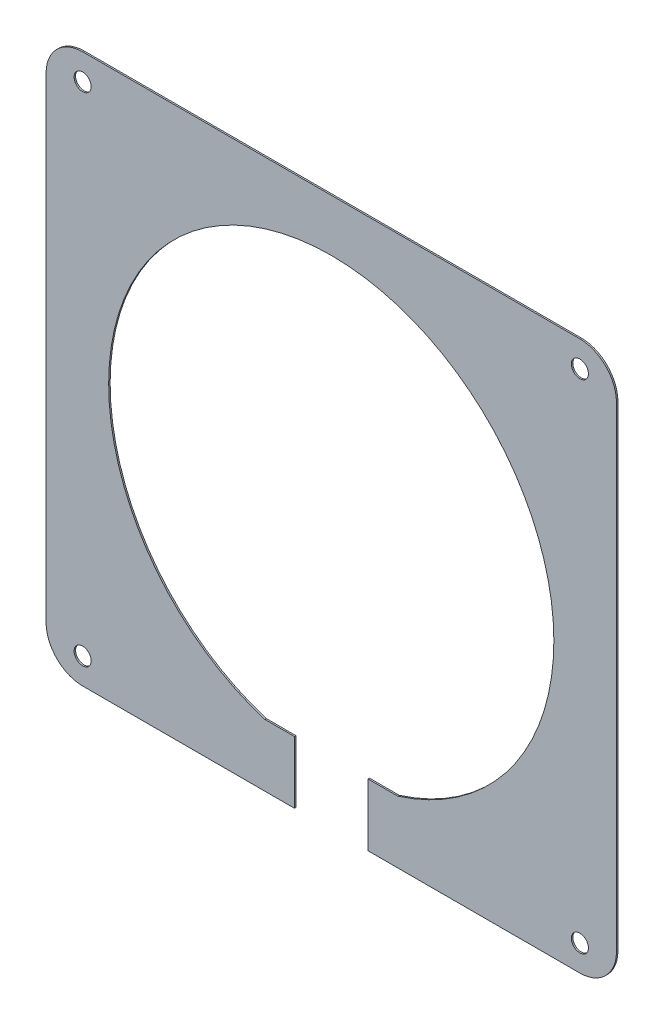
from build123d import *

# Parameters (mm, degrees)
SKETCH2_R           = 1.475
BOSS_EXTRUDE1_DEPTH = 0.254
FILLET1_R           = 6.35


with BuildPart() as part:
    # Sketch2 → Boss-Extrude1 (new body)
    # profile 1 of 3: a face of its own
    with BuildSketch(Plane.XY):
        with BuildLine():
            ThreePointArc((-6.35, -37.972720471), (-8.946176851, -37.446173633), (-11.5, -36.742346142))
            ThreePointArc((-11.5, -36.742346142), (-22.79802623, 31.024184115), (38.5, 0))
            ThreePointArc((38.5, 0), (31.024184115, -22.79802623), (11.5, -36.742346142))
            ThreePointArc((11.5, -36.742346142), (8.946176851, -37.446173633), (6.35, -37.972720471))
            Line((6.35, -37.972720471), (6.35, -47.5))
            Line((6.35, -47.5), (49.325, -47.5))
            Line((49.325, -47.5), (49.325, 47.5))
            Line((49.325, 47.5), (-49.325, 47.5))
            Line((-49.325, 47.5), (-49.325, -47.5))
            Line((-49.325, -47.5), (-6.35, -47.5))
            Line((-6.35, -47.5), (-6.35, -37.972720471))
        make_face()
        with Locations((-43, -43)):
            Circle(SKETCH2_R, mode=Mode.SUBTRACT)
        with Locations((43, -43)):
            Circle(SKETCH2_R, mode=Mode.SUBTRACT)
        with Locations((-43, 43)):
            Circle(SKETCH2_R, mode=Mode.SUBTRACT)
        with Locations((43, 43)):
            Circle(SKETCH2_R, mode=Mode.SUBTRACT)
    # profile 2 of 3: a face of its own
    with BuildSketch(Plane.XY):
        with BuildLine():
            Line((11.5, -36.742346142), (6.35, -36.742346142))
            Line((6.35, -36.742346142), (6.35, -37.972720471))
            ThreePointArc((6.35, -37.972720471), (8.946176851, -37.446173633), (11.5, -36.742346142))
        make_face()
    # profile 3 of 3: a face of its own
    with BuildSketch(Plane.XY):
        with BuildLine():
            Line((-6.35, -36.742346142), (-11.5, -36.742346142))
            ThreePointArc((-11.5, -36.742346142), (-8.946176851, -37.446173633), (-6.35, -37.972720471))
            Line((-6.35, -37.972720471), (-6.35, -36.742346142))
        make_face()
    extrude(amount=BOSS_EXTRUDE1_DEPTH)

    # Fillet1
    fillet1_edges = [part.edges().sort_by_distance(p)[0] for p in [
        (-49.325, -47.5, 0.127),
        (-49.325, 47.5, 0.127),
        (49.325, 47.5, 0.127),
        (49.325, -47.5, 0.127),
    ]]
    fillet(fillet1_edges, radius=FILLET1_R)


solid = part.part
